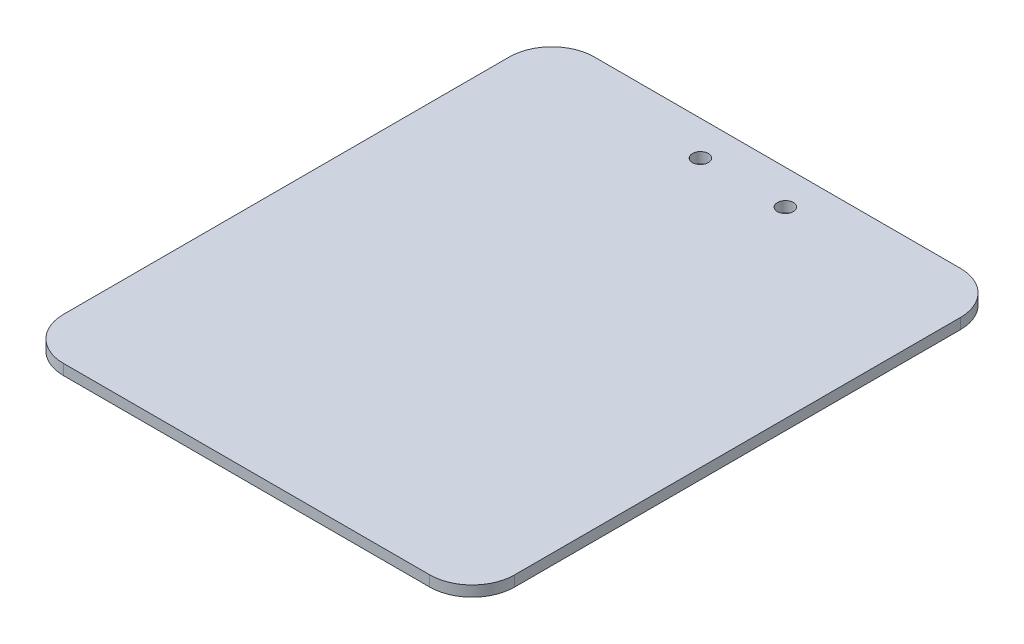
from build123d import *

# Parameters (mm, degrees)
SKETCH1_R           = 1.5
BOSS_EXTRUDE1_DEPTH = 2


with BuildPart() as part:
    # Sketch1 → Boss-Extrude1 (new body)
    with BuildSketch(Plane(origin=(0, 0, 0), x_dir=(1, 0, 0), z_dir=(0, 1, 0))):
        with BuildLine():
            Line((8, 0), (77, 0))
            ThreePointArc((77, 0), (82.656854249, 2.343145751), (85, 8))
            Line((85, 8), (85, 92))
            ThreePointArc((85, 92), (82.656854249, 97.656854249), (77, 100))
            Line((77, 100), (8, 100))
            ThreePointArc((8, 100), (2.343145751, 97.656854249), (0, 92))
            Line((0, 92), (0, 8))
            ThreePointArc((0, 8), (2.343145751, 2.343145751), (8, 0))
        make_face()
        with Locations(Location((50.5, 93.5, 0), (0, 0, 270))):
            Circle(SKETCH1_R, mode=Mode.SUBTRACT)
        with Locations(Location((34.5, 93.5, 0), (0, 0, 90))):
            Circle(SKETCH1_R, mode=Mode.SUBTRACT)
    extrude(amount=BOSS_EXTRUDE1_DEPTH)


solid = part.part
